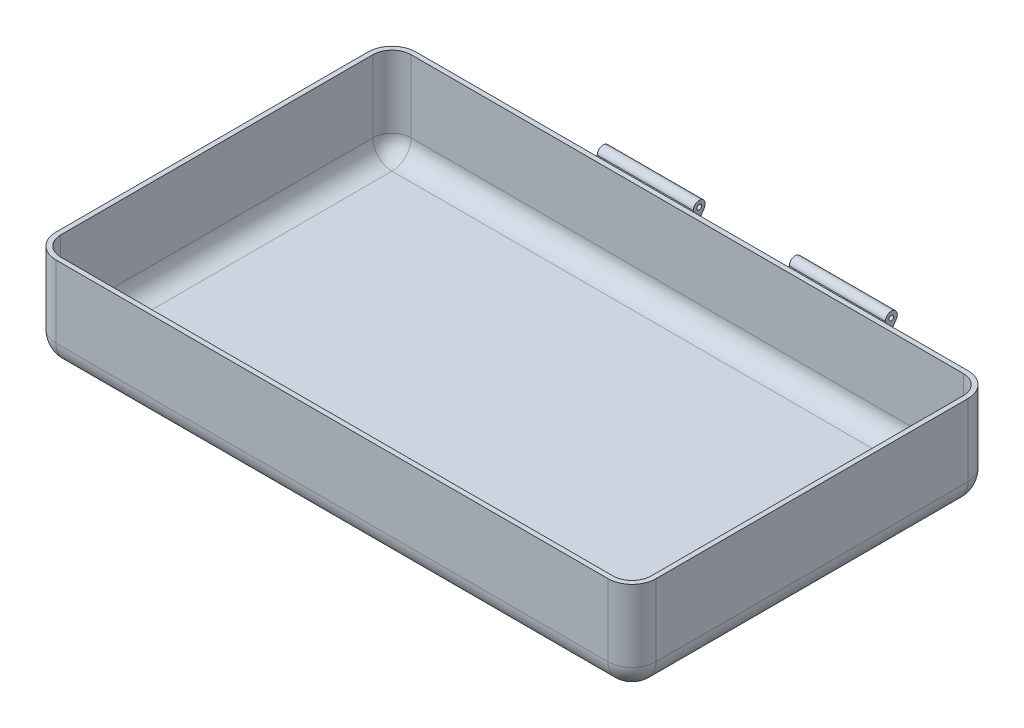
from build123d import *

# Parameters (mm, degrees)
CROQUIS1_W              = 250
CROQUIS1_H              = 150
SALIENTE_EXTRUIR1_DEPTH = 20
REDONDEO1_R             = 10
VACIADO2_T              = -2
SALIENTE_EXTRUIR2_START = 40
CROQUIS2_R              = 1
SALIENTE_EXTRUIR2_DEPTH = 40
SALIENTE_EXTRUIR3_START = -40
CROQUIS2_3_R            = 1
SALIENTE_EXTRUIR3_DEPTH = 40


with BuildPart() as part:
    # Croquis1 → Saliente-Extruir1 (new, symmetric)
    with BuildSketch(Plane(origin=(0, 0, 0), x_dir=(1, 0, 0), z_dir=(0, 1, 0))):
        Rectangle(CROQUIS1_W, CROQUIS1_H)
    extrude(amount=SALIENTE_EXTRUIR1_DEPTH, both=True)

    # Redondeo1
    redondeo1_edges = [part.edges().sort_by_distance(p)[0] for p in [
        (0, -20, -75),
        (-125, 0, -75),
        (125, 0, -75),
        (-125, 0, 75),
        (-125, -20, 0),
        (125, -20, 0),
        (125, 0, 75),
        (0, -20, 75),
    ]]
    fillet(redondeo1_edges, radius=REDONDEO1_R)

    # Vaciado2
    vaciado2_openings = [part.faces().sort_by_distance(p)[0] for p in [
        (0, 20, 0),
    ]]
    offset(amount=VACIADO2_T, openings=vaciado2_openings, kind=Kind.INTERSECTION)

    # Croquis2 → Saliente-Extruir2 (add)
    with BuildSketch(Plane(origin=(0, 0, 0), x_dir=(0, 0, -1), z_dir=(1, 0, 0)).offset(SALIENTE_EXTRUIR2_START)):
        with BuildLine():
            Line((75, 11), (80.079542319, 18.612374783))
            ThreePointArc((80.079542319, 18.612374783), (78.724963517, 22.392577668), (75.5, 20))
            Line((75.5, 20), (75, 19))
            Line((75, 19), (75, 11))
        make_face()
        with Locations((78, 20)):
            Circle(CROQUIS2_R, mode=Mode.SUBTRACT)
    extrude(amount=SALIENTE_EXTRUIR2_DEPTH)

    # Croquis2<3> → Saliente-Extruir3 (add)
    with BuildSketch(Plane(origin=(0, 0, 0), x_dir=(0, 0, -1), z_dir=(1, 0, 0)).offset(SALIENTE_EXTRUIR3_START)):
        with BuildLine():
            Line((75, 11), (80.079542319, 18.612374783))
            ThreePointArc((80.079542319, 18.612374783), (78.724963517, 22.392577668), (75.5, 20))
            Line((75.5, 20), (75, 19))
            Line((75, 19), (75, 11))
        make_face()
        with Locations((78, 20)):
            Circle(CROQUIS2_3_R, mode=Mode.SUBTRACT)
    extrude(amount=SALIENTE_EXTRUIR3_DEPTH)


solid = part.part
